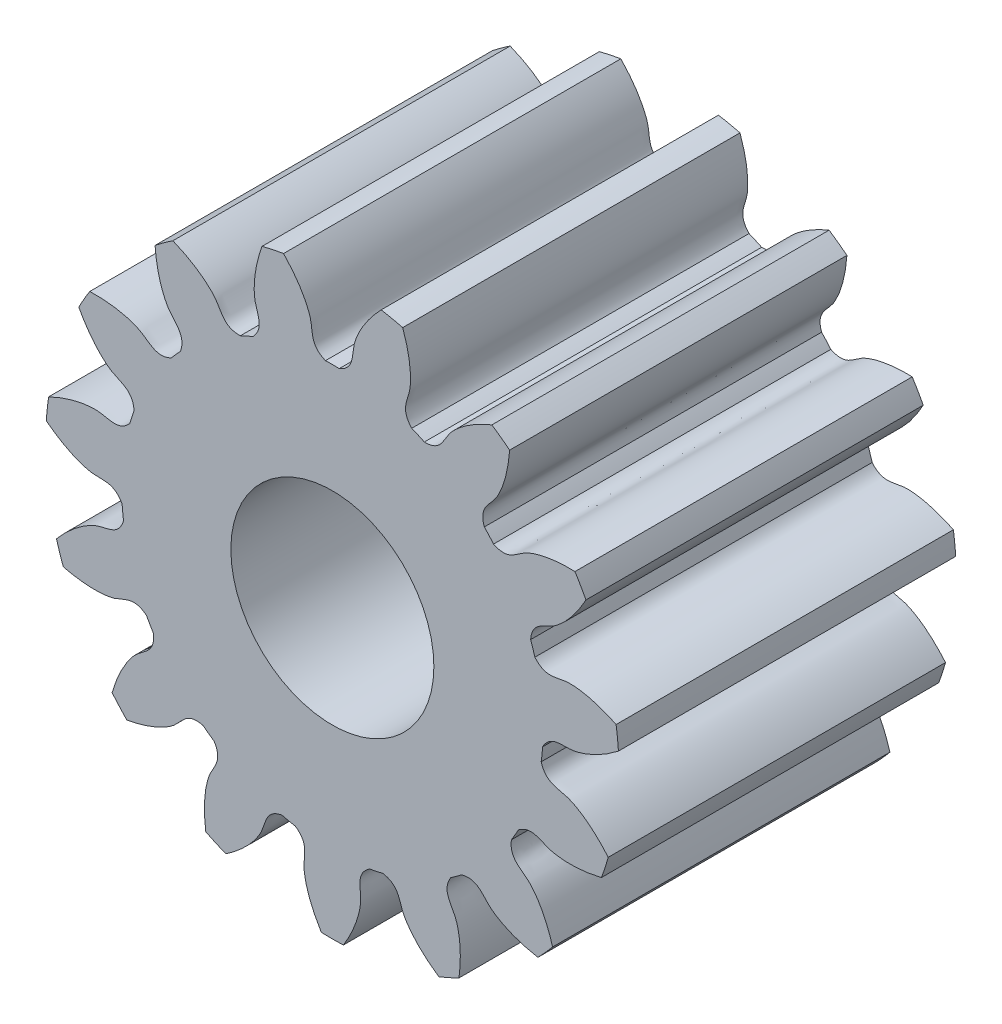
from build123d import *

# Parameters (mm, degrees)
SKETCH_1_R               = 4.25
EXTRUDE_1_DEPTH          = 5
CUT_EXTRUDE_1_DEPTH      = 8.818247886
PATTERN_CIRCULAR_1_COUNT = 15
SKETCH_4_R               = 1.505
CUT_EXTRUDE_2_DEPTH      = 8.81317621


with BuildPart() as part:
    # 草图1 → 凸台-拉伸1 (new body)
    with BuildSketch(Plane.XY):
        Circle(SKETCH_1_R)
    extrude(amount=EXTRUDE_1_DEPTH)

    # 草图2 → 切除-拉伸1 (cut, through all)
    with BuildSketch(Plane.XY):
        with BuildLine():
            ThreePointArc((0.102142521, 3.123330259), (0, 3.125), (-0.102142521, 3.123330259))
            add(Edge.make_bspline(
                [(-0.102142521, 3.123330259), (-0.328606529, 3.217205114), (-0.286056567, 3.393164711), (-0.325630243, 3.554251883), (-0.328716589, 3.565829148), (-0.332424424, 3.578696912), (-0.336805119, 3.592834652), (-0.341911201, 3.608219988), (-0.347794015, 3.624829049), (-0.354504401, 3.642636383), (-0.362092429, 3.661615009), (-0.370607425, 3.68173642), (-0.380097912, 3.702970613), (-0.390611575, 3.725286105), (-0.402195217, 3.748649954), (-0.414894726, 3.773027785), (-0.42875503, 3.798383812), (-0.443820065, 3.824680861), (-0.460132732, 3.851880399), (-0.477734865, 3.87994256), (-0.496667191, 3.908826169), (-0.516969298, 3.938488777), (-0.538679598, 3.968886682), (-0.561835294, 3.999974966), (-0.586472345, 4.031707525), (-0.612625439, 4.064037097), (-0.640327952, 4.096915299), (-0.669611928, 4.130292659), (-0.70050804, 4.164118648), (-0.733045564, 4.198341721), (-0.767252353, 4.232909346), (-0.803154806, 4.267768045), (-0.840777842, 4.30286343), (-0.880144878, 4.33814024), (-0.921277797, 4.373542382), (-0.964196933, 4.409012967), (-1.008921041, 4.444494353), (-1.055467278, 4.479928182), (-1.103851182, 4.515255425), (-1.154086653, 4.550416421), (-1.206185932, 4.585350919), (-1.260159587, 4.619998121), (-1.316016488, 4.654296726), (-1.373763805, 4.688184973), (-1.433406971, 4.721600685), (-1.516292831, 4.765884352), (-1.580075957, 4.797516983), (-1.623419194, 4.817964103)],
                knots=[0, 0, 0, 0, 0.202473101, 0.206978902, 0.212085478, 0.217792827, 0.224100949, 0.231009845, 0.238519514, 0.246629958, 0.255341174, 0.264653164, 0.274565928, 0.285079465, 0.296193776, 0.307908861, 0.320224719, 0.33314135, 0.346658755, 0.360776934, 0.375495886, 0.390815612, 0.406736111, 0.423257384, 0.440379431, 0.458102251, 0.476425844, 0.495350211, 0.514875352, 0.535001266, 0.555727954, 0.577055415, 0.59898365, 0.621512658, 0.64464244, 0.668372996, 0.692704325, 0.717636428, 0.743169304, 0.769302954, 0.796037377, 0.823372574, 0.851308544, 0.879845288, 0.908982806, 0.938721097, 1, 1, 1, 1], degree=3))
            ThreePointArc((-1.623419194, 4.817964103), (0, 5.084119194), (1.623419194, 4.817964103))
            add(Edge.make_bspline(
                [(0.102142521, 3.123330259), (0.328606529, 3.217205114), (0.286056567, 3.393164711), (0.325630243, 3.554251883), (0.328716589, 3.565829148), (0.332424424, 3.578696912), (0.336805119, 3.592834652), (0.341911201, 3.608219988), (0.347794015, 3.624829049), (0.354504401, 3.642636383), (0.362092429, 3.661615009), (0.370607425, 3.68173642), (0.380097912, 3.702970613), (0.390611575, 3.725286105), (0.402195217, 3.748649954), (0.414894726, 3.773027785), (0.42875503, 3.798383812), (0.443820065, 3.824680861), (0.460132732, 3.851880399), (0.477734865, 3.87994256), (0.496667191, 3.908826169), (0.516969298, 3.938488777), (0.538679598, 3.968886682), (0.561835294, 3.999974966), (0.586472345, 4.031707525), (0.612625439, 4.064037097), (0.640327952, 4.096915299), (0.669611928, 4.130292659), (0.70050804, 4.164118648), (0.733045564, 4.198341721), (0.767252353, 4.232909346), (0.803154806, 4.267768045), (0.840777842, 4.30286343), (0.880144878, 4.33814024), (0.921277797, 4.373542382), (0.964196933, 4.409012967), (1.008921041, 4.444494353), (1.055467278, 4.479928182), (1.103851182, 4.515255425), (1.154086653, 4.550416421), (1.206185932, 4.585350919), (1.260159587, 4.619998121), (1.316016488, 4.654296726), (1.373763805, 4.688184973), (1.433406971, 4.721600685), (1.516292831, 4.765884352), (1.580075957, 4.797516983), (1.623419194, 4.817964103)],
                knots=[0, 0, 0, 0, 0.202473101, 0.206978902, 0.212085478, 0.217792827, 0.224100949, 0.231009845, 0.238519514, 0.246629958, 0.255341174, 0.264653164, 0.274565928, 0.285079465, 0.296193776, 0.307908861, 0.320224719, 0.33314135, 0.346658755, 0.360776934, 0.375495886, 0.390815612, 0.406736111, 0.423257384, 0.440379431, 0.458102251, 0.476425844, 0.495350211, 0.514875352, 0.535001266, 0.555727954, 0.577055415, 0.59898365, 0.621512658, 0.64464244, 0.668372996, 0.692704325, 0.717636428, 0.743169304, 0.769302954, 0.796037377, 0.823372574, 0.851308544, 0.879845288, 0.908982806, 0.938721097, 1, 1, 1, 1], degree=3))
        make_face()
    cut_extrude_1 = extrude(amount=CUT_EXTRUDE_1_DEPTH, mode=Mode.SUBTRACT)

    # 阵列(圆周)1: 切除-拉伸1 ×15 about axis
    pattern_circular_1_axis = Axis((0, 0, 5), (0, 0, -1))
    for i in range(1, PATTERN_CIRCULAR_1_COUNT):
        add(cut_extrude_1.rotate(pattern_circular_1_axis, i * 360 / PATTERN_CIRCULAR_1_COUNT), mode=Mode.SUBTRACT)

    # 草图4 → 切除-拉伸2 (cut, through all)
    with BuildSketch(Plane.XY):
        Circle(SKETCH_4_R)
    extrude(amount=CUT_EXTRUDE_2_DEPTH, mode=Mode.SUBTRACT)


solid = part.part
